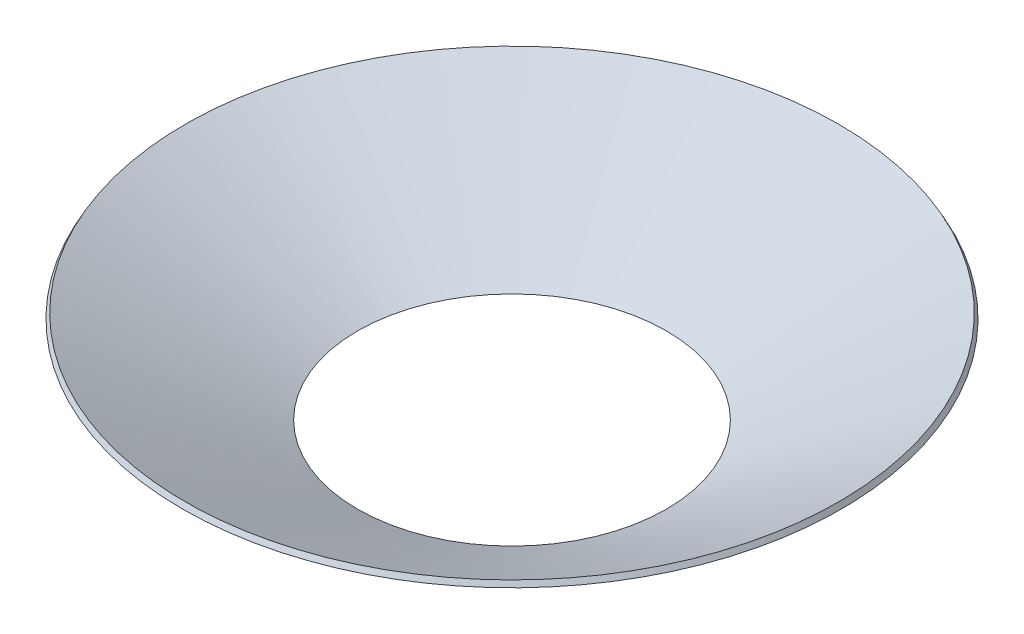
from build123d import *


with BuildPart() as part:
    # Sketch1 → Revolve1 (revolve)
    with BuildSketch(Plane.XY, mode=Mode.PRIVATE) as revolve1_sk:
        Polygon((-29.61320646, 0), (-58.69, 15.619052777), (-58.216785471, 16.5), (-27.5, 0), align=None)
    revolve(revolve1_sk.sketch.rotate(Axis((0, 0, 0), (0, 1, 0)), 270), axis=Axis((0, 0, 0), (0, 1, 0)))


solid = part.part
